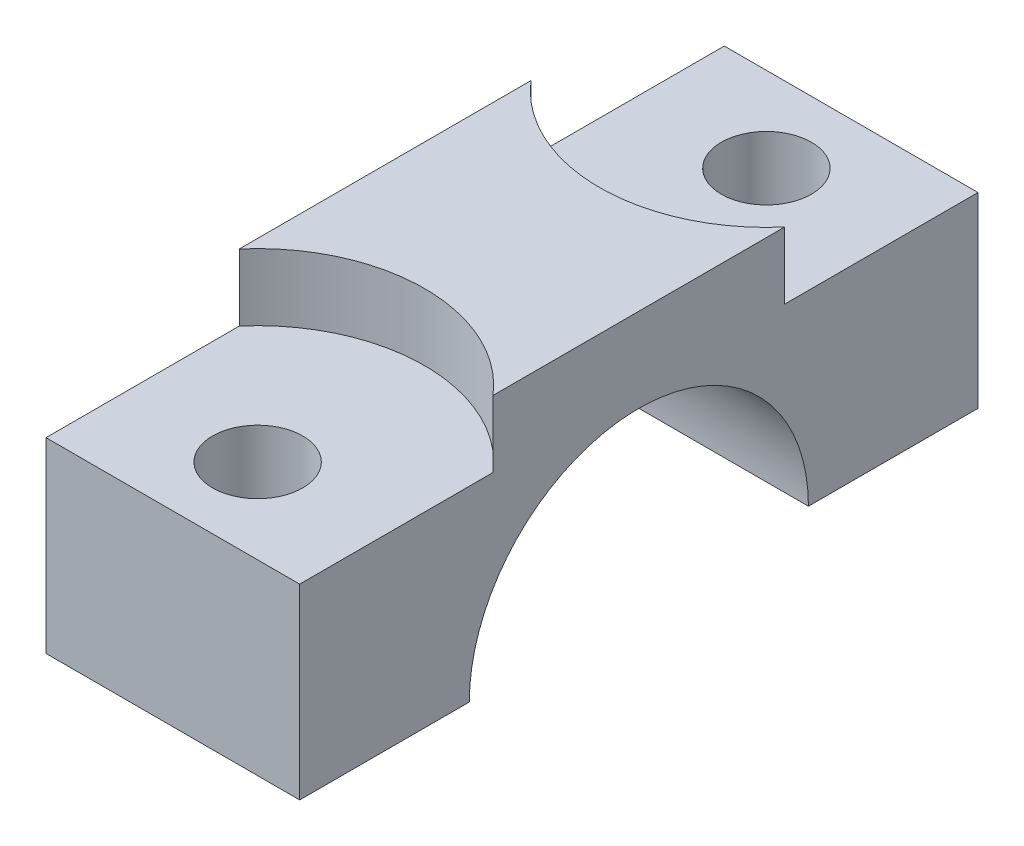
from build123d import *

# Parameters (mm, degrees)
BOSS_EXTRUDE1_DEPTH                           = 9.5
CBORE_FOR_M12_HEX_HEAD_CAP_SCREW2_D           = 6.75
CBORE_FOR_M12_HEX_HEAD_CAP_SCREW2_CBORE_D     = 25
CBORE_FOR_M12_HEX_HEAD_CAP_SCREW2_CBORE_DEPTH = 5
SCALE1_SCALE                                  = 0.51948


with BuildPart() as part:
    # Sketch1 → Boss-Extrude1 (new, symmetric)
    with BuildSketch(Plane(origin=(0, 0, 0), x_dir=(0, 0, -1), z_dir=(1, 0, 0))):
        with BuildLine():
            ThreePointArc((-12.7, 0), (0, 12.7), (12.7, 0))
            Line((12.7, 0), (25.4, 0))
            Line((25.4, 0), (25.4, 19))
            Line((25.4, 19), (-25.4, 19))
            Line((-25.4, 19), (-25.4, 0))
            Line((-25.4, 0), (-12.7, 0))
        make_face()
    extrude(amount=BOSS_EXTRUDE1_DEPTH, both=True)

    # CBORE for M12 Hex Head Cap Screw2 (through all)
    with Locations(Plane(origin=(0, 19, 0), x_dir=(1, 0, 0), z_dir=(0, 1, 0))):
        with Locations((0, 19.05), (0, -19.05)):
            CounterBoreHole(CBORE_FOR_M12_HEX_HEAD_CAP_SCREW2_D / 2, CBORE_FOR_M12_HEX_HEAD_CAP_SCREW2_CBORE_D / 2, CBORE_FOR_M12_HEX_HEAD_CAP_SCREW2_CBORE_DEPTH)


with BuildPart() as part_1:
    # Scale1: scaled about (0, 9.391105983, 0)
    add(part.part.scale(SCALE1_SCALE).moved(Location((0, 4.512614247, 0))))


solid = part_1.part
